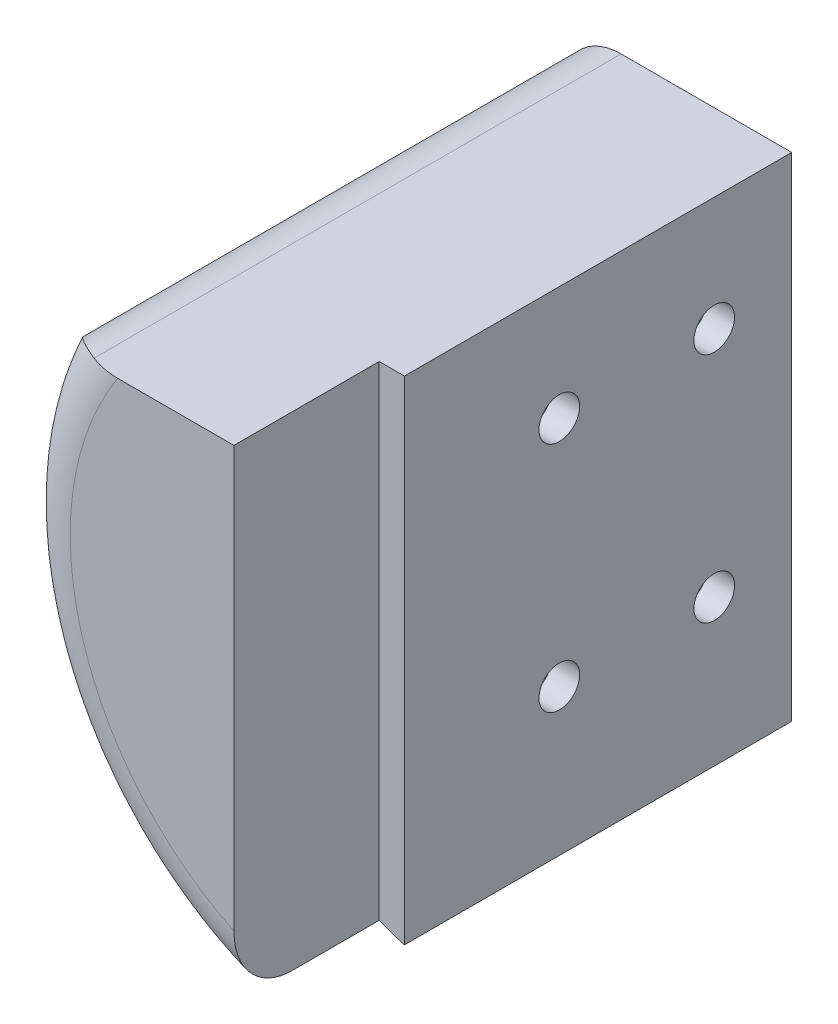
from build123d import *

# Parameters (mm, degrees)
BOSS_EXTRUDE1_DEPTH = 55
SKETCH2_W           = 15
SKETCH2_H           = 50.876134921
CUT_EXTRUDE1_DEPTH  = 2.6
SKETCH3_R           = 2.1
CUT_EXTRUDE2_DEPTH  = 32.6
FILLET2_R           = 6
SKETCH4_R           = 3.65
CUT_EXTRUDE3_DEPTH  = 22.6


with BuildPart() as part:
    # Sketch1 → Boss-Extrude1 (new body)
    with BuildSketch(Plane.XY):
        with BuildLine():
            Line((-10.5, 16.441414071), (-10.5, -34.43472085))
            ThreePointArc((-10.5, -34.43472085), (-33.154419012, -14.027989876), (-32.026237733, 16.441414071))
            Line((-32.026237733, 16.441414071), (-10.5, 16.441414071))
        make_face()
    extrude(amount=BOSS_EXTRUDE1_DEPTH)

    # Sketch2 → Cut-Extrude1 (cut)
    with BuildSketch(Plane(origin=(-10.5, 0, 0), x_dir=(0, 0, -1), z_dir=(1, 0, 0))):
        with Locations((-47.5, -8.99665339)):
            Rectangle(SKETCH2_W, SKETCH2_H)
    extrude(amount=-CUT_EXTRUDE1_DEPTH, mode=Mode.SUBTRACT)

    # Sketch3 → Cut-Extrude2 (cut)
    with BuildSketch(Plane(origin=(-10.5, 0, 0), x_dir=(0, 0, -1), z_dir=(1, 0, 0))):
        with Locations((-8, 4.681414071)):
            Circle(SKETCH3_R)
        with Locations((-24, 4.681414071)):
            Circle(SKETCH3_R)
        with Locations((-24, -19.318585929)):
            Circle(SKETCH3_R)
        with Locations((-8, -19.318585929)):
            Circle(SKETCH3_R)
    extrude(amount=-CUT_EXTRUDE2_DEPTH, mode=Mode.SUBTRACT)

    # Fillet2
    fillet2_edges = [part.edges().sort_by_distance(p)[0] for p in [
        (-33.666422287, -12.750372951, 55),
        (-32.026237733, 16.441414071, 27.5),
    ]]
    fillet(fillet2_edges, radius=FILLET2_R)

    # Sketch4 → Cut-Extrude3 (cut)
    with BuildSketch(Plane.ZY.offset(36)):
        with Locations((8, 4.681414071)):
            Circle(SKETCH4_R)
        with Locations((24, 4.681414071)):
            Circle(SKETCH4_R)
        with Locations((24, -19.318585929)):
            Circle(SKETCH4_R)
        with Locations((8, -19.318585929)):
            Circle(SKETCH4_R)
    extrude(amount=-CUT_EXTRUDE3_DEPTH, mode=Mode.SUBTRACT)


solid = part.part
